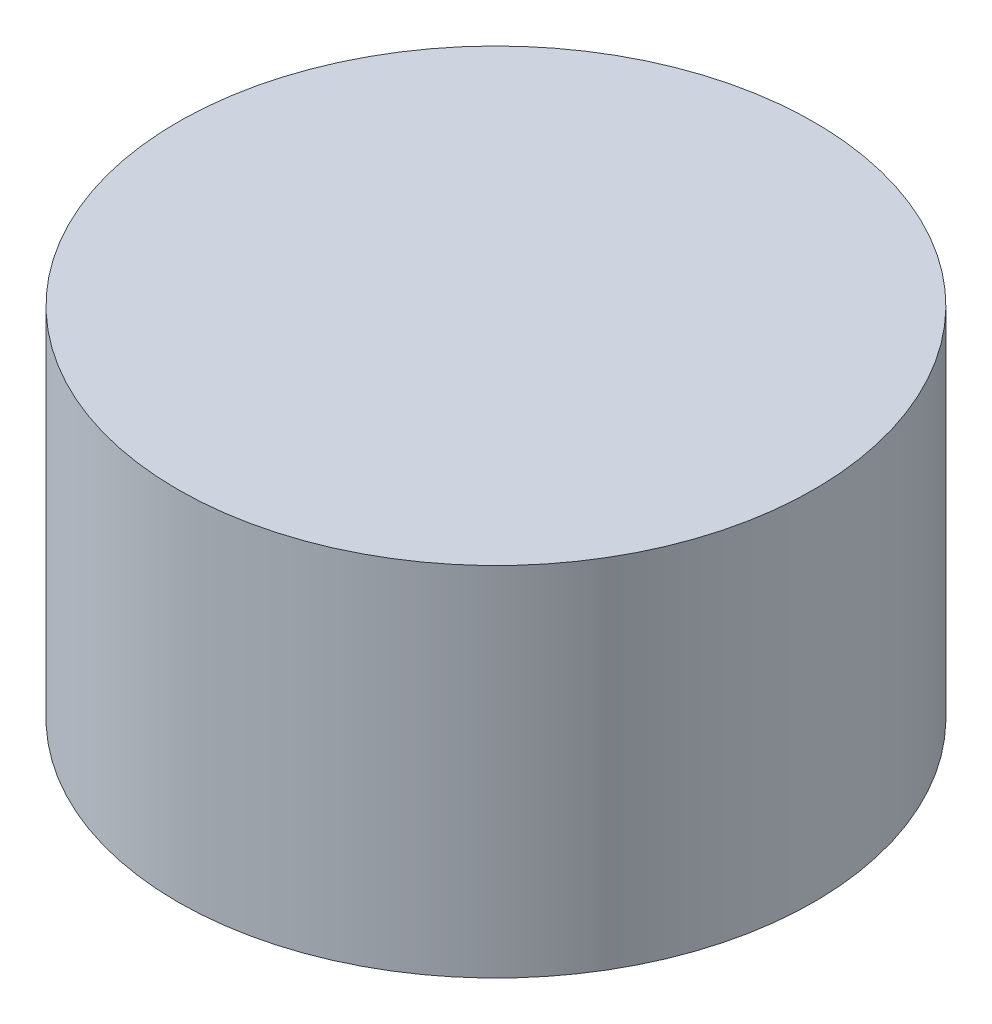
from build123d import *

# Parameters (mm, degrees)
SKETCH1_R           = 14.25
BOSS_EXTRUDE1_DEPTH = 16


with BuildPart() as part:
    # Sketch1 → Boss-Extrude1 (new body)
    with BuildSketch(Plane(origin=(0, 0, 0), x_dir=(1, 0, 0), z_dir=(0, 1, 0))):
        with Locations(Location((0, 0, 0), (0, 0, 270))):
            Circle(SKETCH1_R)
    extrude(amount=BOSS_EXTRUDE1_DEPTH)


solid = part.part
